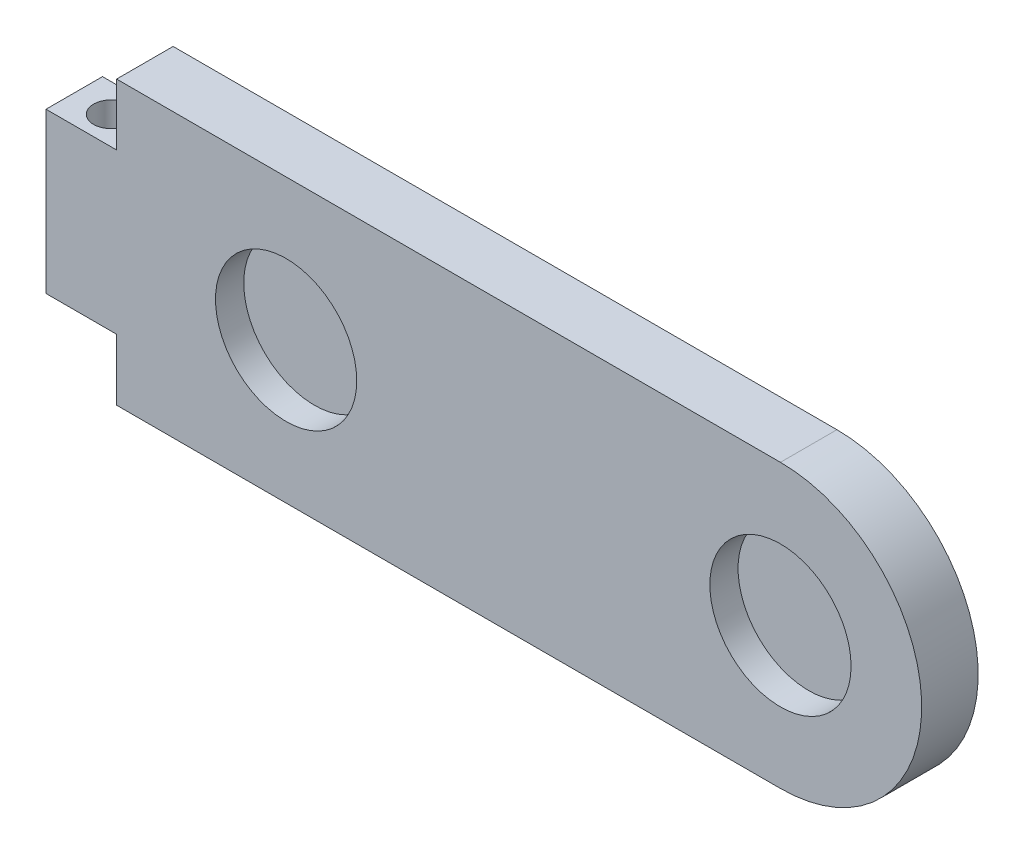
from build123d import *

# Parameters (mm, degrees)
EXTRUDE_1_DEPTH     = 4
SKETCH_2_W          = 4
SKETCH_2_H          = 20
EXTRUDE_2_DEPTH     = 5
SKETCH_3_W          = 5
SKETCH_3_H          = 4.35
CUT_EXTRUDE_1_DEPTH = 4
SKETCH_4_R          = 1.25
CUT_EXTRUDE_2_DEPTH = 11.3
SKETCH_6_R          = 5
CUT_EXTRUDE_4_DEPTH = 2


with BuildPart() as part:
    # 草图1 → 凸台-拉伸1 (new body)
    with BuildSketch(Plane.XY):
        with BuildLine():
            Line((0, 10), (37, 10))
            ThreePointArc((37, 10), (47, 0), (37, -10))
            Line((37, -10), (0, -10))
            Line((0, -10), (-10, -10))
            Line((-10, -10), (-10, 10))
            Line((-10, 10), (0, 10))
        make_face()
    extrude(amount=EXTRUDE_1_DEPTH)

    # 草图2 → 凸台-拉伸2 (add)
    with BuildSketch(Plane.ZY.offset(10)):
        with Locations((2, 0)):
            Rectangle(SKETCH_2_W, SKETCH_2_H)
    extrude(amount=EXTRUDE_2_DEPTH)

    # 草图3 → 切除-拉伸1 (cut)
    with BuildSketch(Plane.XY.offset(4)):
        with Locations((-12.5, 7.825)):
            Rectangle(SKETCH_3_W, SKETCH_3_H)
        with Locations((-12.5, -7.825)):
            Rectangle(SKETCH_3_W, SKETCH_3_H)
    extrude(amount=-CUT_EXTRUDE_1_DEPTH, mode=Mode.SUBTRACT)

    # 草图4 → 切除-拉伸2 (cut)
    with BuildSketch(Plane(origin=(0, 5.65, 0), x_dir=(1, 0, 0), z_dir=(0, 1, 0))):
        with Locations(Location((-12.379659001, -2, 0), (0, 0, 270))):
            Circle(SKETCH_4_R)
    extrude(amount=-CUT_EXTRUDE_2_DEPTH, mode=Mode.SUBTRACT)

    # 草图6 → 切除-拉伸4 (cut)
    with BuildSketch(Plane.XY.offset(4)):
        with Locations((37, 0)):
            Circle(SKETCH_6_R)
        with Locations((2, 0)):
            Circle(SKETCH_6_R)
    extrude(amount=-CUT_EXTRUDE_4_DEPTH, mode=Mode.SUBTRACT)


solid = part.part
